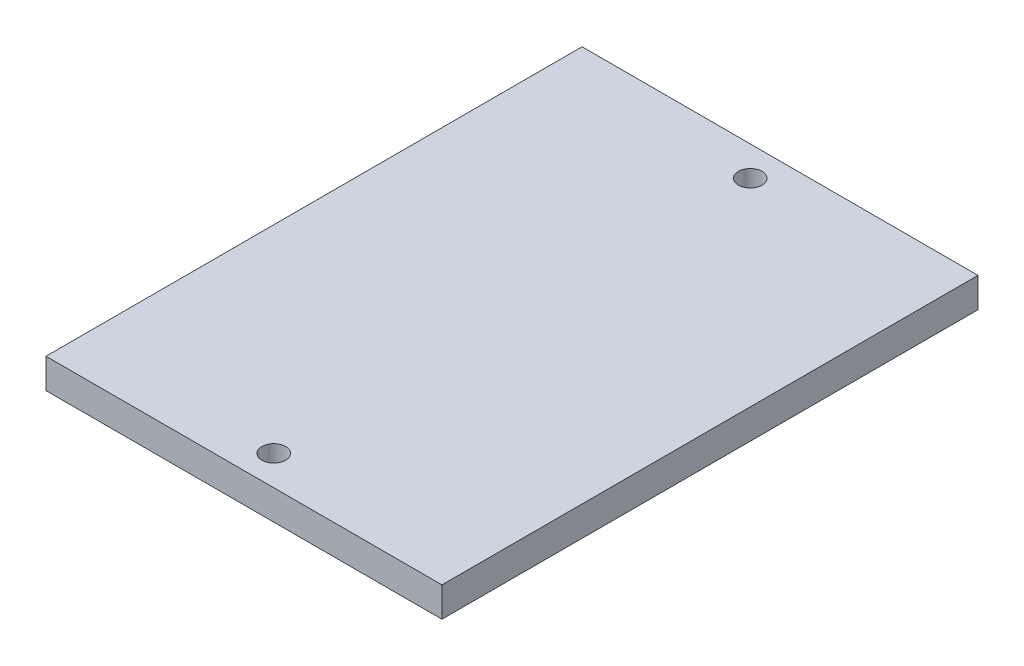
from build123d import *

# Parameters (mm, degrees)
SKETCH1_W           = 84.4263
SKETCH1_H           = 114.3
BOSS_EXTRUDE1_DEPTH = 6.35
SKETCH3_R           = 2.54
CUT_EXTRUDE2_DEPTH  = 9.525


with BuildPart() as part:
    # Sketch1 → Boss-Extrude1 (new body)
    with BuildSketch(Plane(origin=(0, 0, 0), x_dir=(1, 0, 0), z_dir=(0, 1, 0))):
        Rectangle(SKETCH1_W, SKETCH1_H)
    extrude(amount=BOSS_EXTRUDE1_DEPTH)

    # Sketch3 → Cut-Extrude2 (cut)
    with BuildSketch(Plane(origin=(0, 6.35, 0), x_dir=(1, 0, 0), z_dir=(0, 1, 0))):
        with Locations(Location((0, 50.8, 0), (0, 0, 270))):
            Circle(SKETCH3_R)
        with Locations(Location((0, -50.8, 0), (0, 0, 270))):
            Circle(SKETCH3_R)
    extrude(amount=-CUT_EXTRUDE2_DEPTH, mode=Mode.SUBTRACT)


solid = part.part
